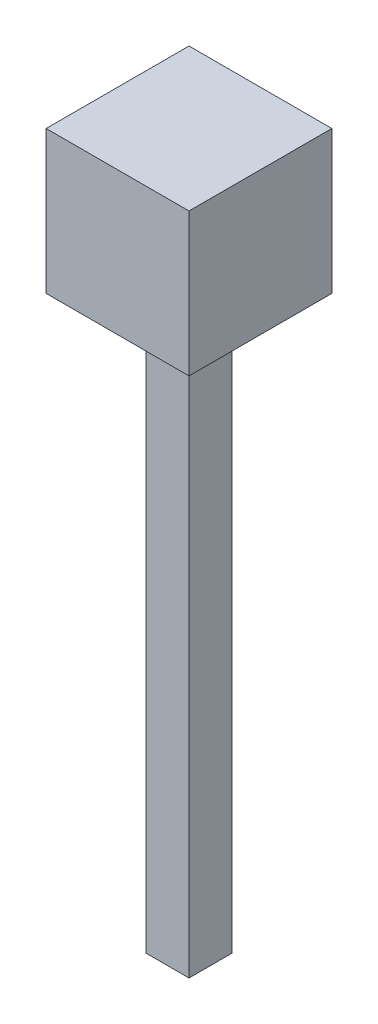
from build123d import *

# Parameters (mm, degrees)
SKETCH1_W           = 6
SKETCH1_H           = 6
BOSS_EXTRUDE1_DEPTH = 100
SKETCH2_W           = 20
SKETCH2_H           = 20
BOSS_EXTRUDE2_DEPTH = 20


with BuildPart() as part:
    # Sketch1 → Boss-Extrude1 (new body)
    with BuildSketch(Plane(origin=(0, 0, 0), x_dir=(1, 0, 0), z_dir=(0, 1, 0))):
        Rectangle(SKETCH1_W, SKETCH1_H)
    extrude(amount=BOSS_EXTRUDE1_DEPTH)

    # Sketch2 → Boss-Extrude2 (add)
    with BuildSketch(Plane(origin=(0, 100, 0), x_dir=(1, 0, 0), z_dir=(0, 1, 0))):
        Rectangle(SKETCH2_W, SKETCH2_H)
    extrude(amount=-BOSS_EXTRUDE2_DEPTH)


solid = part.part
